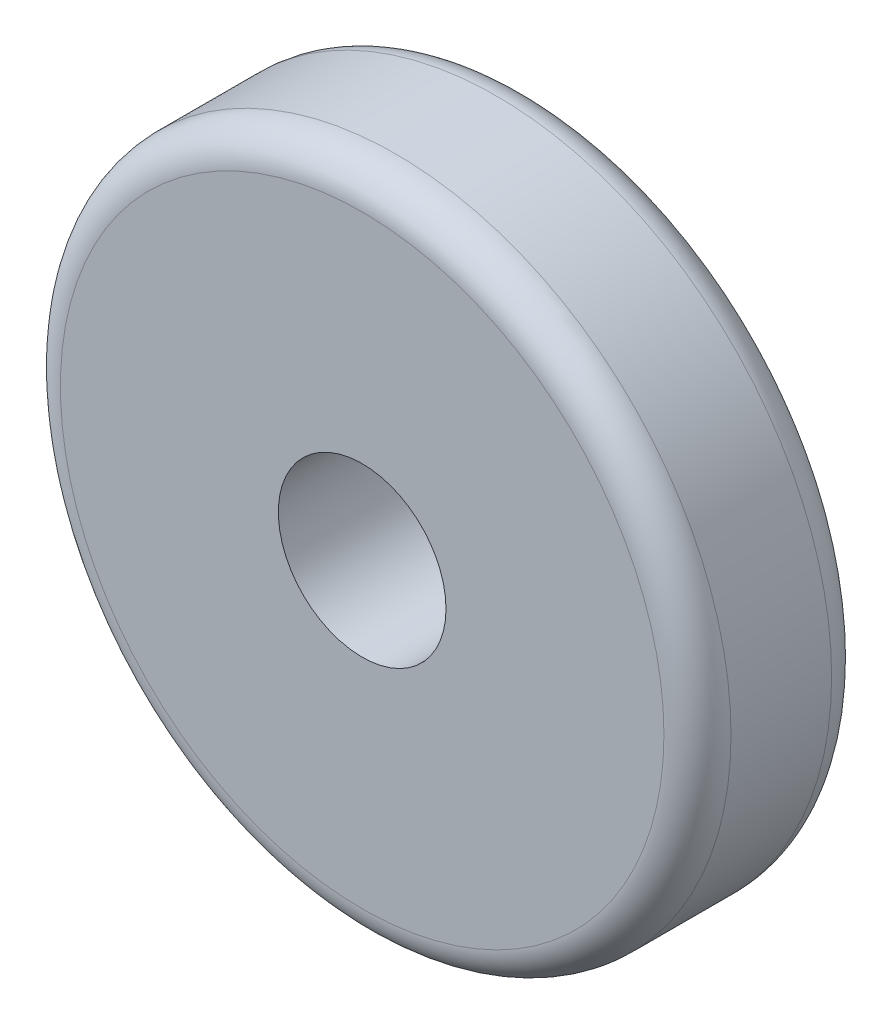
from build123d import *

# Parameters (mm, degrees)
ESBO_O1_R                = 20
RESSALTO_EXTRUS_O1_DEPTH = 5
ESBO_O2_R                = 5
CORTE_EXTRUS_O2_DEPTH    = 5
FILETE3_R                = 2


with BuildPart() as part:
    # Esboço1 → Ressalto-extrusão1 (new, symmetric)
    with BuildSketch(Plane.XY):
        Circle(ESBO_O1_R)
    extrude(amount=RESSALTO_EXTRUS_O1_DEPTH, both=True)

    # Esboço2 → Corte-extrusão2 (cut, symmetric)
    with BuildSketch(Plane.XY):
        Circle(ESBO_O2_R)
    extrude(amount=CORTE_EXTRUS_O2_DEPTH, both=True, mode=Mode.SUBTRACT)

    # Filete3
    filete3_edges = [part.edges().sort_by_distance(p)[0] for p in [
        (-20, 0, -5),
        (-20, 0, 5),
    ]]
    fillet(filete3_edges, radius=FILETE3_R)


solid = part.part
